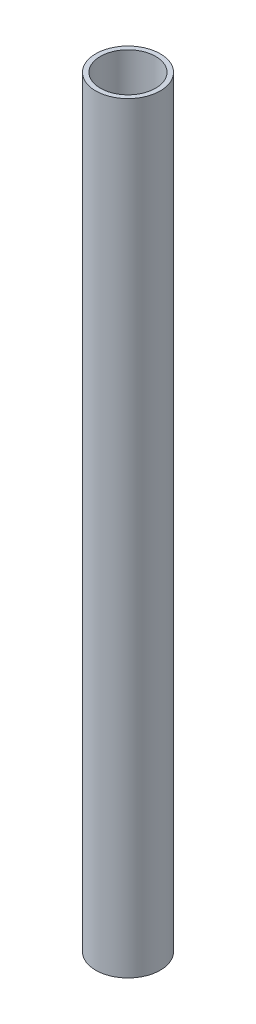
from build123d import *

# Parameters (mm, degrees)
SKETCH1_R           = 44.45
SKETCH1_R_2         = 38.1
BOSS_EXTRUDE1_DEPTH = 525.145


with BuildPart() as part:
    # Sketch1 → Boss-Extrude1 (new, symmetric)
    with BuildSketch(Plane(origin=(0, 0, 0), x_dir=(1, 0, 0), z_dir=(0, 1, 0))):
        with Locations(Location((0, 0, 0), (0, 0, 270))):
            Circle(SKETCH1_R)
        with Locations(Location((0, 0, 0), (0, 0, 270))):
            Circle(SKETCH1_R_2, mode=Mode.SUBTRACT)
    extrude(amount=BOSS_EXTRUDE1_DEPTH, both=True)


solid = part.part
